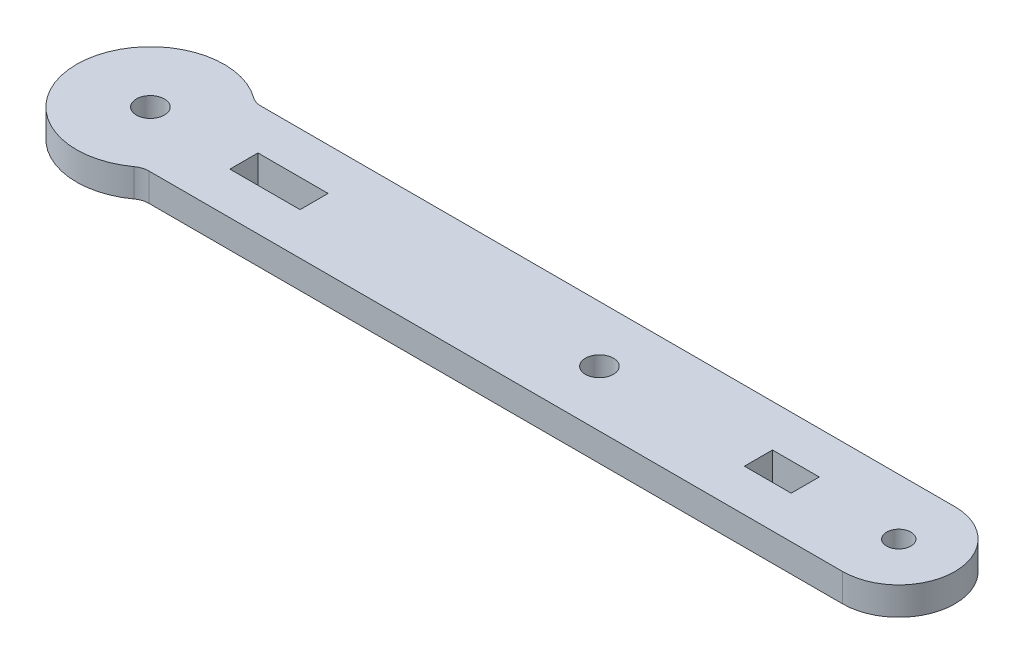
from build123d import *

# Parameters (mm, degrees)
RESSALTO_EXTRUS_O1_DEPTH     = 3
ESBO_O2_W                    = 5
ESBO_O2_H                    = 3
ESBO_O2_W_2                  = 7.5
CORTE_EXTRUS_O1_DEPTH        = 87.414177078
FURO_DE_DI_METRO_3_0_3_1_D   = 3
FURO_DE_DI_METRO_2_6_2_6_1_D = 2.6
FILETE1_R                    = 2


with BuildPart() as part:
    # Esboço1 → Ressalto-extrusão1 (new body)
    with BuildSketch(Plane(origin=(0, 0, 0), x_dir=(1, 0, 0), z_dir=(0, 1, 0))):
        with BuildLine():
            Line((80, 6), (5.139066063, 6))
            ThreePointArc((5.139066063, 6), (-7.9, 0), (5.139066063, -6))
            Line((5.139066063, -6), (80, -6))
            ThreePointArc((80, -6), (86, 0), (80, 6))
        make_face()
    extrude(amount=RESSALTO_EXTRUS_O1_DEPTH)

    # Esboço2 → Corte-extrusão1 (cut, through all)
    with BuildSketch(Plane(origin=(0, 0, 0), x_dir=(1, 0, 0), z_dir=(0, 1, 0))):
        with Locations((67.5, 0)):
            Rectangle(ESBO_O2_W, ESBO_O2_H)
        with Locations((13.75, 0)):
            Rectangle(ESBO_O2_W_2, ESBO_O2_H)
    extrude(amount=CORTE_EXTRUS_O1_DEPTH, mode=Mode.SUBTRACT)

    # Furo de diâmetro Ø3.0 (3)1 (through all)
    with Locations(Plane(origin=(0, 3, 0), x_dir=(1, 0, 0), z_dir=(0, 1, 0))):
        with Locations((0, 0), (48, 0)):
            Hole(FURO_DE_DI_METRO_3_0_3_1_D / 2)

    # Furo de diâmetro Ø2.6 (2.6)1 (through all)
    with Locations(Plane(origin=(0, 3, 0), x_dir=(1, 0, 0), z_dir=(0, 1, 0))):
        with Locations((80, 0)):
            Hole(FURO_DE_DI_METRO_2_6_2_6_1_D / 2)

    # Filete1
    filete1_edges = [part.edges().sort_by_distance(p)[0] for p in [
        (5.139066063, 1.5, 6),
        (5.139066063, 1.5, -6),
    ]]
    fillet(filete1_edges, radius=FILETE1_R)


solid = part.part
